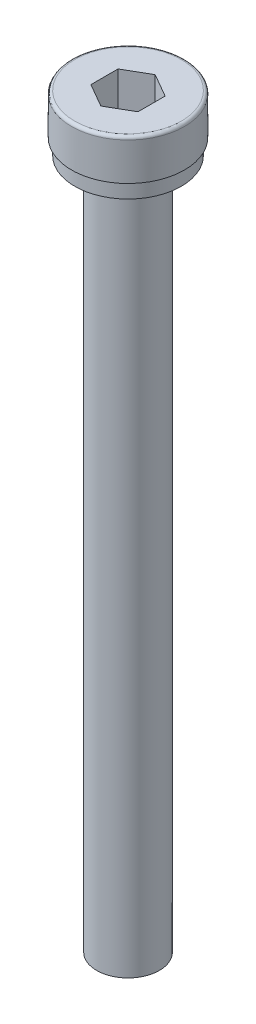
from build123d import *

# Parameters (mm, degrees)
CUT_EXTRUDE1_DEPTH = 1.3
FILLET1_R          = 0.1
CUT_EXTRUDE2_START = -0.5
SKETCH3_R          = 1.8
SKETCH3_R_2        = 1.7
CUT_EXTRUDE2_DEPTH = 0.5


with BuildPart() as part:
    # Sketch1 → Revolve1 (revolve)
    with BuildSketch(Plane(origin=(0, 0, 0), x_dir=(0, 0, -1), z_dir=(1, 0, 0))):
        Polygon((0, 0), (0, -23.8), (1, -23.8), (1, -1.8), (1.8, -1.8), (1.8, 0), align=None)
    revolve(axis=Axis((0, 0, 0), (0, 1, 0)))

    # Sketch2 → Cut-Extrude1 (cut)
    with BuildSketch(Plane(origin=(0, 0, 0), x_dir=(1, 0, 0), z_dir=(0, 1, 0))):
        Polygon((0, 0.866025404), (-0.75, 0.433012702), (-0.75, -0.433012702), (0, -0.866025404), (0.75, -0.433012702), (0.75, 0.433012702), align=None)
    extrude(amount=-CUT_EXTRUDE1_DEPTH, mode=Mode.SUBTRACT)

    # Fillet1
    fillet1_edges = [part.edges().sort_by_distance(p)[0] for p in [
        (0, 0, 1.8),
    ]]
    fillet(fillet1_edges, radius=FILLET1_R)

    # Sketch3 → Cut-Extrude2 (cut)
    with BuildSketch(Plane.XZ.offset(1.8).offset(CUT_EXTRUDE2_START)):
        with Locations(Location((0, 0, 0), (0, 0, 270))):
            Circle(SKETCH3_R)
        with Locations(Location((0, 0, 0), (0, 0, 270))):
            Circle(SKETCH3_R_2, mode=Mode.SUBTRACT)
    extrude(amount=CUT_EXTRUDE2_DEPTH, mode=Mode.SUBTRACT)


solid = part.part
